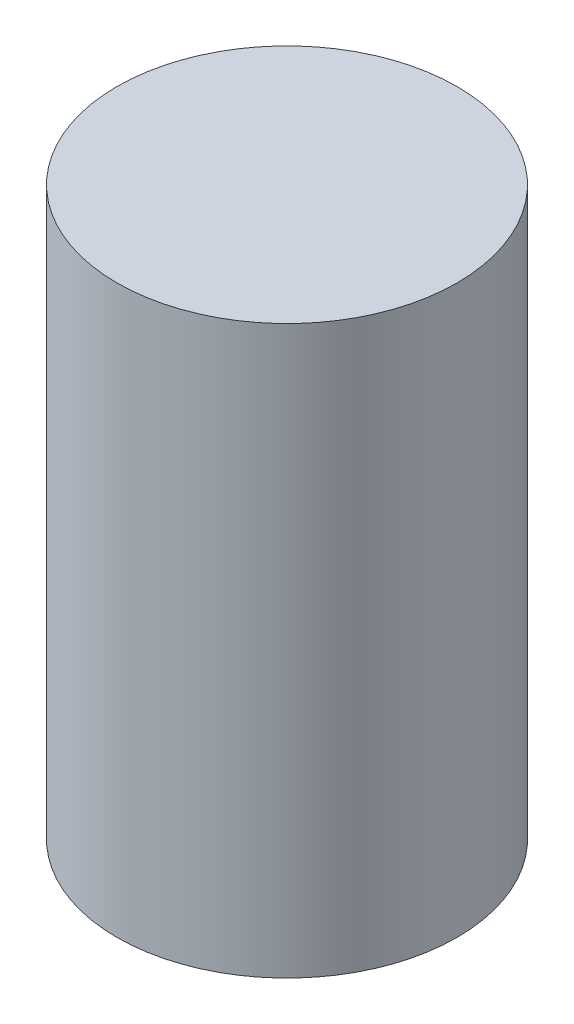
from build123d import *

# Parameters (mm, degrees)
SKETCH_1_R      = 4.5
EXTRUDE_2_DEPTH = 15


with BuildPart() as part:
    # 草图1 → 凸台-拉伸2 (new body)
    with BuildSketch(Plane(origin=(0, 0, 0), x_dir=(1, 0, 0), z_dir=(0, 1, 0))):
        with Locations(Location((-8.522217636, 2.114535203, 0), (0, 0, 270))):
            Circle(SKETCH_1_R)
    extrude(amount=EXTRUDE_2_DEPTH)


solid = part.part
